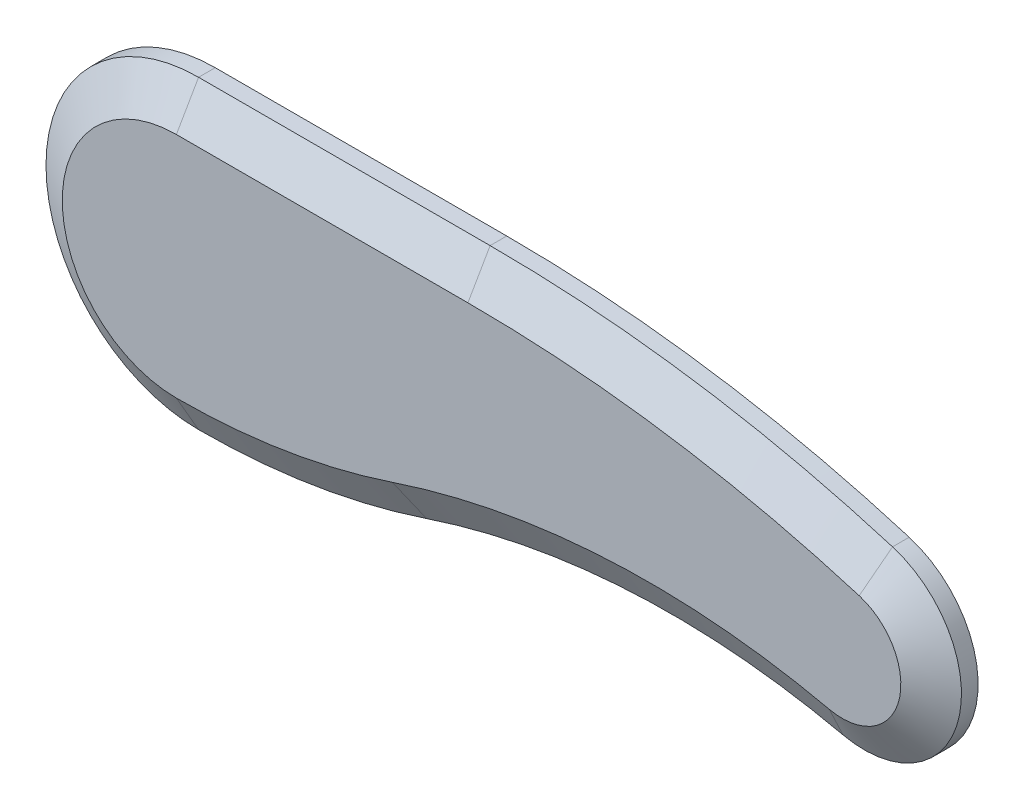
from build123d import *
from OCP.BRepFilletAPI import BRepFilletAPI_MakeChamfer

# Parameters (mm, degrees)
BOSS_EXTRUDE1_DEPTH = 7
CHAMFER1_SIZE       = 4
CHAMFER1_SIZE2      = 6.92820323
SKETCH3_R           = 8.5
CUT_EXTRUDE2_DEPTH  = 4
CUT_EXTRUDE3_DEPTH  = 3.5
SKETCH5_3_R         = 2.125
CUT_EXTRUDE4_DEPTH  = 141.295224438
CHAMFER2_SIZE       = 0.5
CHAMFER2_SIZE2      = 1.37373871
BOSS_EXTRUDE2_START = 0.5
SKETCH7_R           = 9.5
SKETCH7_R_2         = 8.5
BOSS_EXTRUDE2_DEPTH = 0.5


with BuildPart() as part:
    # Sketch1 → Boss-Extrude1 (new body)
    with BuildSketch(Plane.XY):
        with BuildLine():
            Line((52.546312184, 27.5), (0, 27.5))
            ThreePointArc((0, 27.5), (-27.5, 0), (0, -27.5))
            ThreePointArc((0, -27.5), (20.821970152, -25.821648832), (41.106300643, -20.829931677))
            ThreePointArc((41.106300643, -20.829931677), (78.372680186, -13.821988034), (116.152736046, -17.071864575))
            ThreePointArc((116.152736046, -17.071864575), (136.920766347, -4.465161388), (125.077159298, 16.747311828))
            ThreePointArc((125.077159298, 16.747311828), (89.208090939, 24.797217895), (52.546312184, 27.5))
        make_face()
    extrude(amount=BOSS_EXTRUDE1_DEPTH)

    # Chamfer1: one chamfer whose edges measure the first distance from different faces: ONE call of the kernel's chamfer builder (chamfer() names one face for all edges)
    chamfer1_edges_1 = [part.edges().sort_by_distance(p)[0] for p in [
        (20.821970152, -25.821648832, 7),
    ]]
    chamfer1_side_1 = [part.faces().sort_by_distance(p)[0] for p in [
        (20.821970152, -25.821648832, 3.5),
    ]]
    chamfer1_edges_2 = [part.edges().sort_by_distance(p)[0] for p in [
        (-27.5, 0, 7),
    ]]
    chamfer1_side_2 = [part.faces().sort_by_distance(p)[0] for p in [
        (-27.5, 0, 3.5),
    ]]
    chamfer1_edges_3 = [part.edges().sort_by_distance(p)[0] for p in [
        (26.273156092, 27.5, 7),
    ]]
    chamfer1_side_3 = [part.faces().sort_by_distance(p)[0] for p in [
        (26.273156092, 27.5, 3.5),
    ]]
    chamfer1_edges_4 = [part.edges().sort_by_distance(p)[0] for p in [
        (89.208090939, 24.797217895, 7),
    ]]
    chamfer1_side_4 = [part.faces().sort_by_distance(p)[0] for p in [
        (89.208090939, 24.797217895, 3.5),
    ]]
    chamfer1_edges_5 = [part.edges().sort_by_distance(p)[0] for p in [
        (136.920766347, -4.465161388, 7),
    ]]
    chamfer1_side_5 = [part.faces().sort_by_distance(p)[0] for p in [
        (136.920766347, -4.465161388, 3.5),
    ]]
    chamfer1_edges_6 = [part.edges().sort_by_distance(p)[0] for p in [
        (78.372680186, -13.821988034, 7),
    ]]
    chamfer1_side_6 = [part.faces().sort_by_distance(p)[0] for p in [
        (78.372680186, -13.821988034, 3.5),
    ]]
    chamfer1 = BRepFilletAPI_MakeChamfer(part.part.solid().wrapped)
    for e in chamfer1_edges_1:
        chamfer1.Add(CHAMFER1_SIZE, CHAMFER1_SIZE2, e.wrapped, chamfer1_side_1[0].wrapped)  # the first distance lies on this face
    for e in chamfer1_edges_2:
        chamfer1.Add(CHAMFER1_SIZE, CHAMFER1_SIZE2, e.wrapped, chamfer1_side_2[0].wrapped)  # the first distance lies on this face
    for e in chamfer1_edges_3:
        chamfer1.Add(CHAMFER1_SIZE, CHAMFER1_SIZE2, e.wrapped, chamfer1_side_3[0].wrapped)  # the first distance lies on this face
    for e in chamfer1_edges_4:
        chamfer1.Add(CHAMFER1_SIZE, CHAMFER1_SIZE2, e.wrapped, chamfer1_side_4[0].wrapped)  # the first distance lies on this face
    for e in chamfer1_edges_5:
        chamfer1.Add(CHAMFER1_SIZE, CHAMFER1_SIZE2, e.wrapped, chamfer1_side_5[0].wrapped)  # the first distance lies on this face
    for e in chamfer1_edges_6:
        chamfer1.Add(CHAMFER1_SIZE, CHAMFER1_SIZE2, e.wrapped, chamfer1_side_6[0].wrapped)  # the first distance lies on this face
    add(Compound.cast(chamfer1.Shape()), mode=Mode.REPLACE)

    # Sketch3 → Cut-Extrude2 (cut)
    with BuildSketch(Plane(origin=(0, 0, 0), x_dir=(-1, 0, 0), z_dir=(0, 0, -1))):
        Circle(SKETCH3_R)
        with Locations((-120, 0)):
            Circle(SKETCH3_R)
    extrude(amount=-CUT_EXTRUDE2_DEPTH, mode=Mode.SUBTRACT)

    # Sketch5 → Cut-Extrude3 (cut)
    with BuildSketch(Plane(origin=(0, 0, 2.5), x_dir=(-1, 0, 0), z_dir=(0, 0, -1))):
        with BuildLine():
            Line((-86.046403676, 16.921929528), (-88.139298402, 13.296929528))
            Line((-88.139298402, 13.296929528), (-86.046403676, 9.671929528))
            Line((-86.046403676, 9.671929528), (-78.548867374, 9.671929528))
            ThreePointArc((-78.548867374, 9.671929528), (-67.767719499, 13.296929528), (-78.548867374, 16.921929528))
            Line((-78.548867374, 16.921929528), (-86.046403676, 16.921929528))
        make_face()
        with BuildLine():
            Line((-62.092894726, -3.625), (-54.595358423, -3.625))
            ThreePointArc((-54.595358423, -3.625), (-43.814210548, 0), (-54.595358423, 3.625))
            Line((-54.595358423, 3.625), (-62.092894726, 3.625))
            Line((-62.092894726, 3.625), (-64.185789452, 0))
            Line((-64.185789452, 0), (-62.092894726, -3.625))
        make_face()
        with BuildLine():
            Line((-32.163058591, -14.569644586), (-24.665522288, -14.569644586))
            ThreePointArc((-24.665522288, -14.569644586), (-13.884374414, -10.944644586), (-24.665522288, -7.319644586))
            Line((-24.665522288, -7.319644586), (-32.163058591, -7.319644586))
            Line((-32.163058591, -7.319644586), (-34.255953317, -10.944644586))
            Line((-34.255953317, -10.944644586), (-32.163058591, -14.569644586))
        make_face()
    extrude(amount=-CUT_EXTRUDE3_DEPTH, mode=Mode.SUBTRACT)

    # Sketch5<3> → Cut-Extrude4 (cut, through all)
    with BuildSketch(Plane(origin=(0, 0, 2.5), x_dir=(-1, 0, 0), z_dir=(0, 0, -1))):
        with BuildLine():
            ThreePointArc((-78.548867374, 9.671929528), (-67.767719499, 13.296929528), (-78.548867374, 16.921929528))
            ThreePointArc((-78.548867374, 16.921929528), (-79.767719499, 13.296929528), (-78.548867374, 9.671929528))
        make_face()
        with BuildLine():
            ThreePointArc((-54.595358423, 3.625), (-55.814210548, 0), (-54.595358423, -3.625))
            ThreePointArc((-54.595358423, -3.625), (-43.814210548, 0), (-54.595358423, 3.625))
        make_face()
        with BuildLine():
            ThreePointArc((-24.665522288, -7.319644586), (-25.884374414, -10.944644586), (-24.665522288, -14.569644586))
            ThreePointArc((-24.665522288, -14.569644586), (-13.884374414, -10.944644586), (-24.665522288, -7.319644586))
        make_face()
        with Locations((-83.953508951, 13.296929528)):
            Circle(SKETCH5_3_R)
        with Locations((-60, 0)):
            Circle(SKETCH5_3_R)
        with Locations((-30.070163865, -10.944644586)):
            Circle(SKETCH5_3_R)
    extrude(amount=CUT_EXTRUDE4_DEPTH, mode=Mode.SUBTRACT)

    # Chamfer2: one chamfer whose edges measure the first distance from different faces: ONE call of the kernel's chamfer builder (chamfer() names one face for all edges)
    chamfer2_edges_1 = [part.edges().sort_by_distance(p)[0] for p in [
        (67.767719499, 13.296929528, 6),
    ]]
    chamfer2_side_1 = [part.faces().sort_by_distance(p)[0] for p in [
        (68.986571624, 9.671929528, 3),
    ]]
    chamfer2_edges_2 = [part.edges().sort_by_distance(p)[0] for p in [
        (13.884374414, -10.944644586, 6),
    ]]
    chamfer2_side_2 = [part.faces().sort_by_distance(p)[0] for p in [
        (15.103226539, -14.569644586, 3),
    ]]
    chamfer2_edges_3 = [part.edges().sort_by_distance(p)[0] for p in [
        (43.814210548, 0, 6),
    ]]
    chamfer2_side_3 = [part.faces().sort_by_distance(p)[0] for p in [
        (45.033062674, -3.625, 3),
    ]]
    chamfer2 = BRepFilletAPI_MakeChamfer(part.part.solid().wrapped)
    for e in chamfer2_edges_1:
        chamfer2.Add(CHAMFER2_SIZE, CHAMFER2_SIZE2, e.wrapped, chamfer2_side_1[0].wrapped)  # the first distance lies on this face
    for e in chamfer2_edges_2:
        chamfer2.Add(CHAMFER2_SIZE, CHAMFER2_SIZE2, e.wrapped, chamfer2_side_2[0].wrapped)  # the first distance lies on this face
    for e in chamfer2_edges_3:
        chamfer2.Add(CHAMFER2_SIZE, CHAMFER2_SIZE2, e.wrapped, chamfer2_side_3[0].wrapped)  # the first distance lies on this face
    add(Compound.cast(chamfer2.Shape()), mode=Mode.REPLACE)

    # Sketch7 → Boss-Extrude2 (add)
    # profile 1 of 2: a face of its own
    with BuildSketch(Plane(origin=(0, 0, 0), x_dir=(-1, 0, 0), z_dir=(0, 0, -1)).offset(BOSS_EXTRUDE2_START)):
        Circle(SKETCH7_R)
        Circle(SKETCH7_R_2, mode=Mode.SUBTRACT)
    # profile 2 of 2: a face of its own
    with BuildSketch(Plane(origin=(0, 0, 0), x_dir=(-1, 0, 0), z_dir=(0, 0, -1)).offset(BOSS_EXTRUDE2_START)):
        with Locations((-120, 0)):
            Circle(SKETCH7_R)
        with Locations((-120, 0)):
            Circle(SKETCH7_R_2, mode=Mode.SUBTRACT)
    extrude(amount=-BOSS_EXTRUDE2_DEPTH)


solid = part.part
